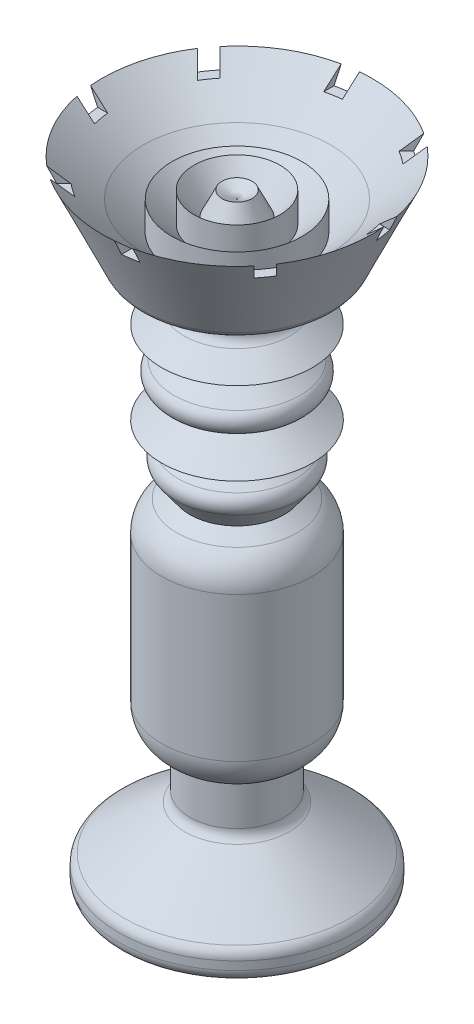
from build123d import *

# Parameters (mm, degrees)
FILLET1_R          = 7.62
FILLET2_R          = 7.62
FILLET3_R          = 2.54
FILLET4_R          = 2.54
FILLET7_R          = 2.54
FILLET8_R          = 2.54
FILLET9_R          = 2.54
SKETCH2_W          = 3.264324392
SKETCH2_H          = 6.37532256
CUT_EXTRUDE3_DEPTH = 41.402
CIRPATTERN3_COUNT  = 8


with BuildPart() as part:
    # Sketch1 → Revolve2 (revolve)
    with BuildSketch(Plane.XY, mode=Mode.PRIVATE) as revolve2_sk:
        Polygon((0, 32.948502172), (0, -89.243915593), (24.161353754, -89.243915593), (24.161353754, -83.710674034), (9.636594661, -73.105294378), (9.636594661, -63.42212165), (15.400387952, -60.65550087), (15.400387952, -46.130741778), (15.400387952, -35.294810391), (15.400387952, -22.383913419), (9.636594661, -18.175429429), (14.037347928, -12.148310825), (9.636594661, -8.935062408), (15.400387952, -6.168441628), (5.347764705, 0), (19.185437006, 0), (8.799518989, 7.583368711), (15.400387952, 10.751785814), (7.402295313, 16.591662978), (19.185437006, 22.247570991), (27.631821828, 40.531309107), (19.185437006, 32.948502172), (13.29386616, 27.056931325), (13.29386616, 32.948502172), (8.799518989, 28.454155001), (8.799518989, 34.562364294), (5.347764705, 29.834961688), (3.078611454, 34.562364294), align=None)
    revolve(revolve2_sk.sketch.rotate(Axis((0, 32.948502172, 0), (0, -1, 0)), 90), axis=Axis((0, 32.948502172, 0), (0, -1, 0)))

    # Fillet1
    fillet1_edges = [part.edges().sort_by_distance(p)[0] for p in [
        (0, -22.383913419, -15.400387952),
    ]]
    fillet(fillet1_edges, radius=FILLET1_R)

    # Fillet2
    fillet2_edges = [part.edges().sort_by_distance(p)[0] for p in [
        (0, -60.65550087, -15.400387952),
    ]]
    fillet(fillet2_edges, radius=FILLET2_R)

    # Fillet3
    fillet3_edges = [part.edges().sort_by_distance(p)[0] for p in [
        (0, -73.105294378, -9.636594661),
    ]]
    fillet(fillet3_edges, radius=FILLET3_R)

    # Fillet4
    fillet4_edges = [part.edges().sort_by_distance(p)[0] for p in [
        (0, -89.243915593, -24.161353754),
        (0, -83.710674034, -24.161353754),
    ]]
    fillet(fillet4_edges, radius=FILLET4_R)

    # Fillet7
    fillet7_edges = [part.edges().sort_by_distance(p)[0] for p in [
        (0, 0, -19.185437006),
    ]]
    fillet(fillet7_edges, radius=FILLET7_R)

    # Fillet8
    fillet8_edges = [part.edges().sort_by_distance(p)[0] for p in [
        (0, -12.148310825, -14.037347928),
    ]]
    fillet(fillet8_edges, radius=FILLET8_R)

    # Fillet9
    fillet9_edges = [part.edges().sort_by_distance(p)[0] for p in [
        (0, 16.591662978, -7.402295313),
        (0, 22.247570991, -19.185437006),
    ]]
    fillet(fillet9_edges, radius=FILLET9_R)

    # Sketch2 → Cut-Extrude3 (cut)
    with BuildSketch(Plane.XY):
        with Locations((-4.078764411, 40.578995726)):
            Rectangle(SKETCH2_W, SKETCH2_H)
    cut_extrude3 = extrude(amount=-CUT_EXTRUDE3_DEPTH, mode=Mode.SUBTRACT)

    # CirPattern3: Cut-Extrude3 ×8 about axis
    cirpattern3_axis = Axis((0, 0, 0), (0, 1, 0))
    for i in range(1, CIRPATTERN3_COUNT):
        add(cut_extrude3.rotate(cirpattern3_axis, i * 360 / CIRPATTERN3_COUNT), mode=Mode.SUBTRACT)


solid = part.part
